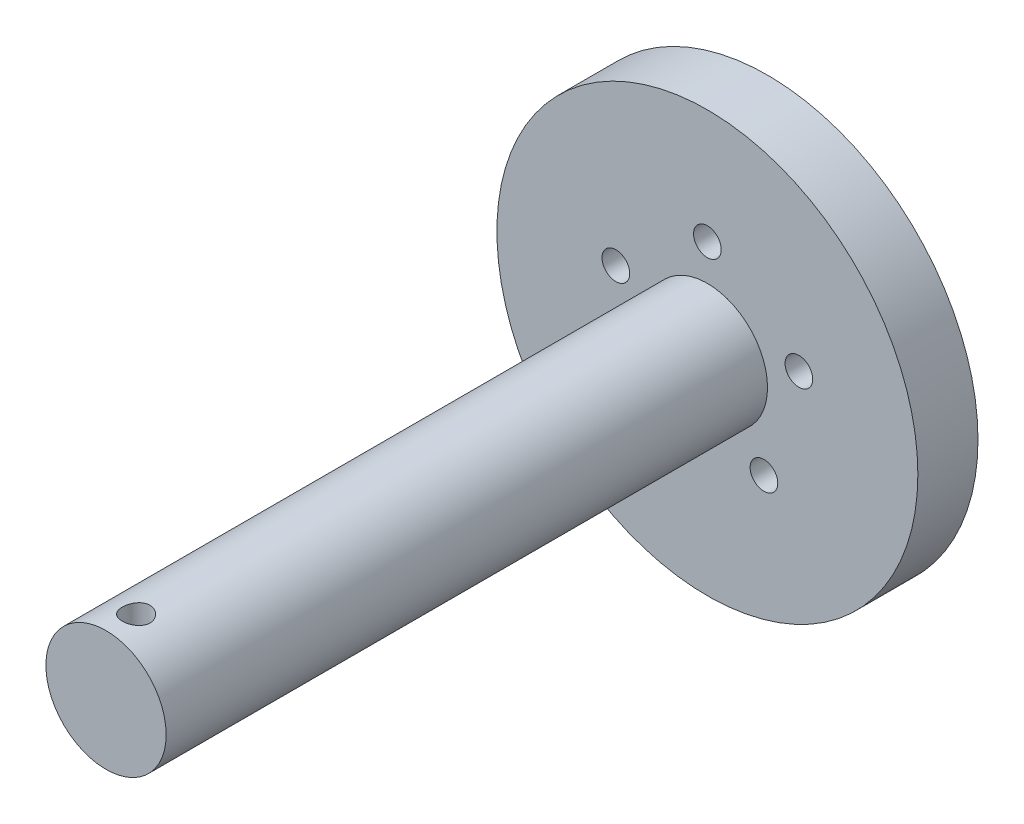
from build123d import *

# Parameters (mm, degrees)
SKETCH1_R           = 44.45
SKETCH1_R_2         = 2.921
BOSS_EXTRUDE1_DEPTH = 12.7
SKETCH2_R           = 12.7
BOSS_EXTRUDE2_DEPTH = 127
CUT_EXTRUDE1_REACH  = 159.347
SKETCH4_R           = 2.921


with BuildPart() as part:
    # Sketch1 → Boss-Extrude1 (new body)
    with BuildSketch(Plane.XY):
        Circle(SKETCH1_R)
        with Locations((0, 20.32)):
            Circle(SKETCH1_R_2, mode=Mode.SUBTRACT)
        with Locations((19.325468411, 6.279225326)):
            Circle(SKETCH1_R_2, mode=Mode.SUBTRACT)
        with Locations((11.943796327, -16.439225326)):
            Circle(SKETCH1_R_2, mode=Mode.SUBTRACT)
        with Locations((-11.943796327, -16.439225326)):
            Circle(SKETCH1_R_2, mode=Mode.SUBTRACT)
        with Locations((-19.325468411, 6.279225326)):
            Circle(SKETCH1_R_2, mode=Mode.SUBTRACT)
    extrude(amount=BOSS_EXTRUDE1_DEPTH)

    # Sketch2 → Boss-Extrude2 (add)
    with BuildSketch(Plane.XY.offset(12.7)):
        Circle(SKETCH2_R)
    extrude(amount=BOSS_EXTRUDE2_DEPTH)

    # Sketch4 → Cut-Extrude1 (cut, up to next)
    with BuildSketch(Plane(origin=(0, -12.7, 0), x_dir=(-1, 0, 0), z_dir=(0, -1, 0)), mode=Mode.PRIVATE) as cut_extrude1_sk1:
        with Locations(Location((0, -133.35, 0), (0, 0, 90))):
            Circle(SKETCH4_R)
    cut_extrude1_tool1 = extrude(cut_extrude1_sk1.sketch, amount=-CUT_EXTRUDE1_REACH, mode=Mode.PRIVATE) & part.part
    add(cut_extrude1_tool1.solids().sort_by_distance((0, -12.7, 133.35))[0], mode=Mode.SUBTRACT)


solid = part.part
